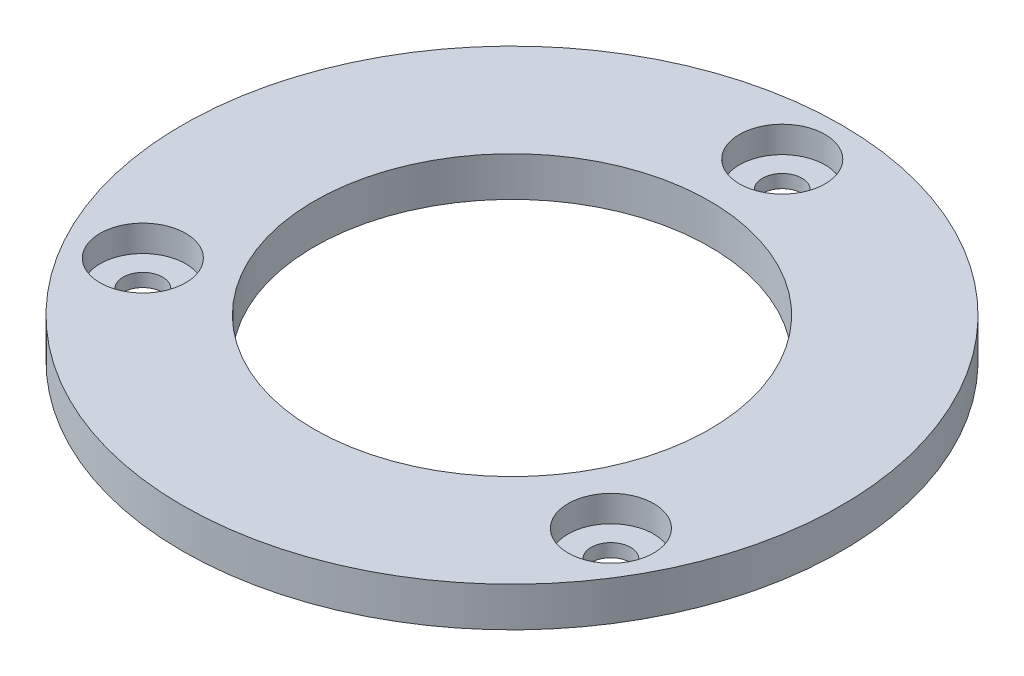
from build123d import *

# Parameters (mm, degrees)
SKETCH1_R           = 25
SKETCH1_R_2         = 1.5
SKETCH1_R_3         = 15
BOSS_EXTRUDE1_DEPTH = 3
SKETCH2_R           = 3.25
CUT_EXTRUDE1_DEPTH  = 2


with BuildPart() as part:
    # Sketch1 → Boss-Extrude1 (new body)
    with BuildSketch(Plane(origin=(0, 0, 0), x_dir=(1, 0, 0), z_dir=(0, 1, 0))):
        with Locations(Location((0, 0, 0), (0, 0, 270))):
            Circle(SKETCH1_R)
        with Locations(Location((0, 20.5, 0), (0, 0, 270))):
            Circle(SKETCH1_R_2, mode=Mode.SUBTRACT)
        with Locations(Location((17.753520778, -10.25, 0), (0, 0, 270))):
            Circle(SKETCH1_R_2, mode=Mode.SUBTRACT)
        with Locations(Location((-17.753520778, -10.25, 0), (0, 0, 270))):
            Circle(SKETCH1_R_2, mode=Mode.SUBTRACT)
        with Locations(Location((0, 0, 0), (0, 0, 270))):
            Circle(SKETCH1_R_3, mode=Mode.SUBTRACT)
    extrude(amount=BOSS_EXTRUDE1_DEPTH)

    # Sketch2 → Cut-Extrude1 (cut)
    with BuildSketch(Plane(origin=(0, 3, 0), x_dir=(1, 0, 0), z_dir=(0, 1, 0))):
        with Locations(Location((0, 20.5, 0), (0, 0, 270))):
            Circle(SKETCH2_R)
        with Locations(Location((17.753520778, -10.25, 0), (0, 0, 270))):
            Circle(SKETCH2_R)
        with Locations(Location((-17.753520778, -10.25, 0), (0, 0, 270))):
            Circle(SKETCH2_R)
    extrude(amount=-CUT_EXTRUDE1_DEPTH, mode=Mode.SUBTRACT)


solid = part.part
